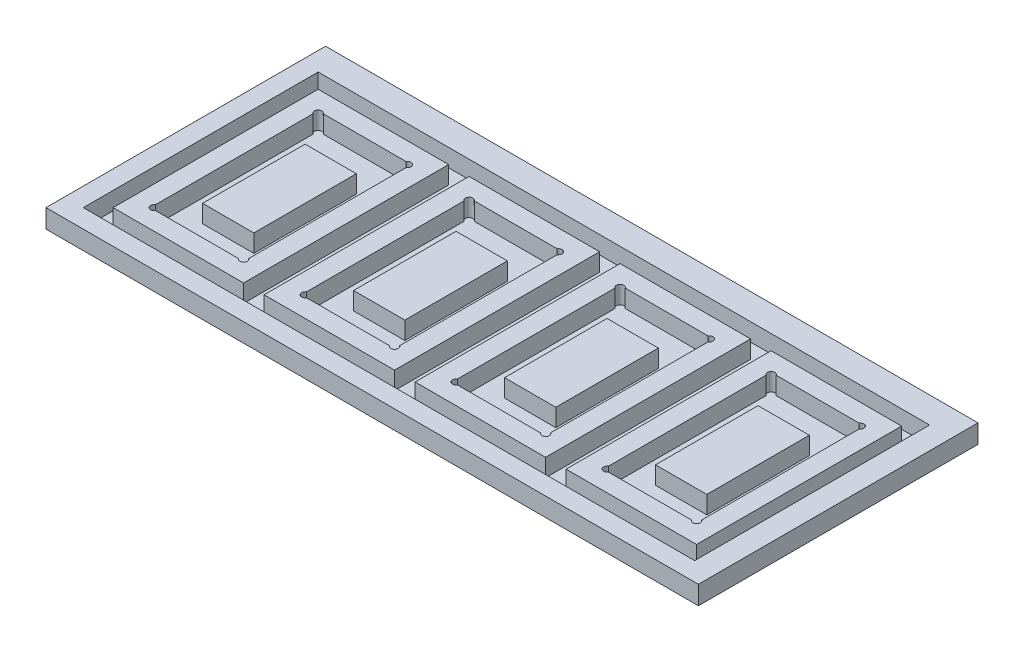
from build123d import *

# Parameters (mm, degrees)
SKETCH1_W           = 350
SKETCH1_H           = 150
BOSS_EXTRUDE1_DEPTH = 10
SKETCH2_W           = 328
SKETCH2_H           = 126
SKETCH2_W_2         = 70
SKETCH2_H_2         = 110
SKETCH2_W_3         = 27.5
SKETCH2_H_3         = 55
CUT_EXTRUDE1_DEPTH  = 9.5


with BuildPart() as part:
    # Sketch1 → Boss-Extrude1 (new body)
    with BuildSketch(Plane(origin=(0, 0, 0), x_dir=(1, 0, 0), z_dir=(0, 1, 0))):
        Rectangle(SKETCH1_W, SKETCH1_H)
    extrude(amount=BOSS_EXTRUDE1_DEPTH)

    # Sketch2 → Cut-Extrude1 (cut)
    # profile 1 of 5: a face of its own
    with BuildSketch(Plane(origin=(0, 10, 0), x_dir=(1, 0, 0), z_dir=(0, 1, 0))):
        with Locations((-1, -2)):
            Rectangle(SKETCH2_W, SKETCH2_H)
        with Locations((-122, -2)):
            Rectangle(SKETCH2_W_2, SKETCH2_H_2, mode=Mode.SUBTRACT)
        with Locations((-41, -2)):
            Rectangle(SKETCH2_W_2, SKETCH2_H_2, mode=Mode.SUBTRACT)
        with Locations((40, -2)):
            Rectangle(SKETCH2_W_2, SKETCH2_H_2, mode=Mode.SUBTRACT)
        with Locations((121, -2)):
            Rectangle(SKETCH2_W_2, SKETCH2_H_2, mode=Mode.SUBTRACT)
    # profile 2 of 5: a face of its own
    with BuildSketch(Plane(origin=(0, 10, 0), x_dir=(1, 0, 0), z_dir=(0, 1, 0))):
        with BuildLine():
            Line((-147, -44.243757332), (-147, 40.243757332))
            ThreePointArc((-147, 40.243757332), (-147.353553391, 43.353553391), (-144.243757332, 43))
            Line((-144.243757332, 43), (-99.756242668, 43))
            ThreePointArc((-99.756242668, 43), (-96.646446609, 43.353553391), (-97, 40.243757332))
            Line((-97, 40.243757332), (-97, -44.243757332))
            ThreePointArc((-97, -44.243757332), (-96.646446609, -47.353553391), (-99.756242668, -47))
            Line((-99.756242668, -47), (-144.243757332, -47))
            ThreePointArc((-144.243757332, -47), (-147.353553391, -47.353553391), (-147, -44.243757332))
        make_face()
        with Locations((-121.25, -3.5)):
            Rectangle(SKETCH2_W_3, SKETCH2_H_3, mode=Mode.SUBTRACT)
    # profile 3 of 5: a face of its own
    with BuildSketch(Plane(origin=(0, 10, 0), x_dir=(1, 0, 0), z_dir=(0, 1, 0))):
        with BuildLine():
            Line((-66, -44.243757332), (-66, 40.243757332))
            ThreePointArc((-66, 40.243757332), (-66.353553391, 43.353553391), (-63.243757332, 43))
            Line((-63.243757332, 43), (-18.756242668, 43))
            ThreePointArc((-18.756242668, 43), (-15.646446609, 43.353553391), (-16, 40.243757332))
            Line((-16, 40.243757332), (-16, -44.243757332))
            ThreePointArc((-16, -44.243757332), (-15.646446609, -47.353553391), (-18.756242668, -47))
            Line((-18.756242668, -47), (-63.243757332, -47))
            ThreePointArc((-63.243757332, -47), (-66.353553391, -47.353553391), (-66, -44.243757332))
        make_face()
        with Locations((-40.25, -3.5)):
            Rectangle(SKETCH2_W_3, SKETCH2_H_3, mode=Mode.SUBTRACT)
    # profile 4 of 5: a face of its own
    with BuildSketch(Plane(origin=(0, 10, 0), x_dir=(1, 0, 0), z_dir=(0, 1, 0))):
        with BuildLine():
            Line((15, -44.243757332), (15, 40.243757332))
            ThreePointArc((15, 40.243757332), (14.646446609, 43.353553391), (17.756242668, 43))
            Line((17.756242668, 43), (62.243757332, 43))
            ThreePointArc((62.243757332, 43), (65.353553391, 43.353553391), (65, 40.243757332))
            Line((65, 40.243757332), (65, -44.243757332))
            ThreePointArc((65, -44.243757332), (65.353553391, -47.353553391), (62.243757332, -47))
            Line((62.243757332, -47), (17.756242668, -47))
            ThreePointArc((17.756242668, -47), (14.646446609, -47.353553391), (15, -44.243757332))
        make_face()
        with Locations((40.75, -3.5)):
            Rectangle(SKETCH2_W_3, SKETCH2_H_3, mode=Mode.SUBTRACT)
    # profile 5 of 5: a face of its own
    with BuildSketch(Plane(origin=(0, 10, 0), x_dir=(1, 0, 0), z_dir=(0, 1, 0))):
        with BuildLine():
            Line((98.756242668, -47), (143.243757332, -47))
            ThreePointArc((143.243757332, -47), (146.353553391, -47.353553391), (146, -44.243757332))
            Line((146, -44.243757332), (146, 40.243757332))
            ThreePointArc((146, 40.243757332), (146.353553391, 43.353553391), (143.243757332, 43))
            Line((143.243757332, 43), (98.756242668, 43))
            ThreePointArc((98.756242668, 43), (95.646446609, 43.353553391), (96, 40.243757332))
            Line((96, 40.243757332), (96, -44.243757332))
            ThreePointArc((96, -44.243757332), (95.646446609, -47.353553391), (98.756242668, -47))
        make_face()
        with Locations((121.75, -3.5)):
            Rectangle(SKETCH2_W_3, SKETCH2_H_3, mode=Mode.SUBTRACT)
    extrude(amount=-CUT_EXTRUDE1_DEPTH, mode=Mode.SUBTRACT)


solid = part.part
